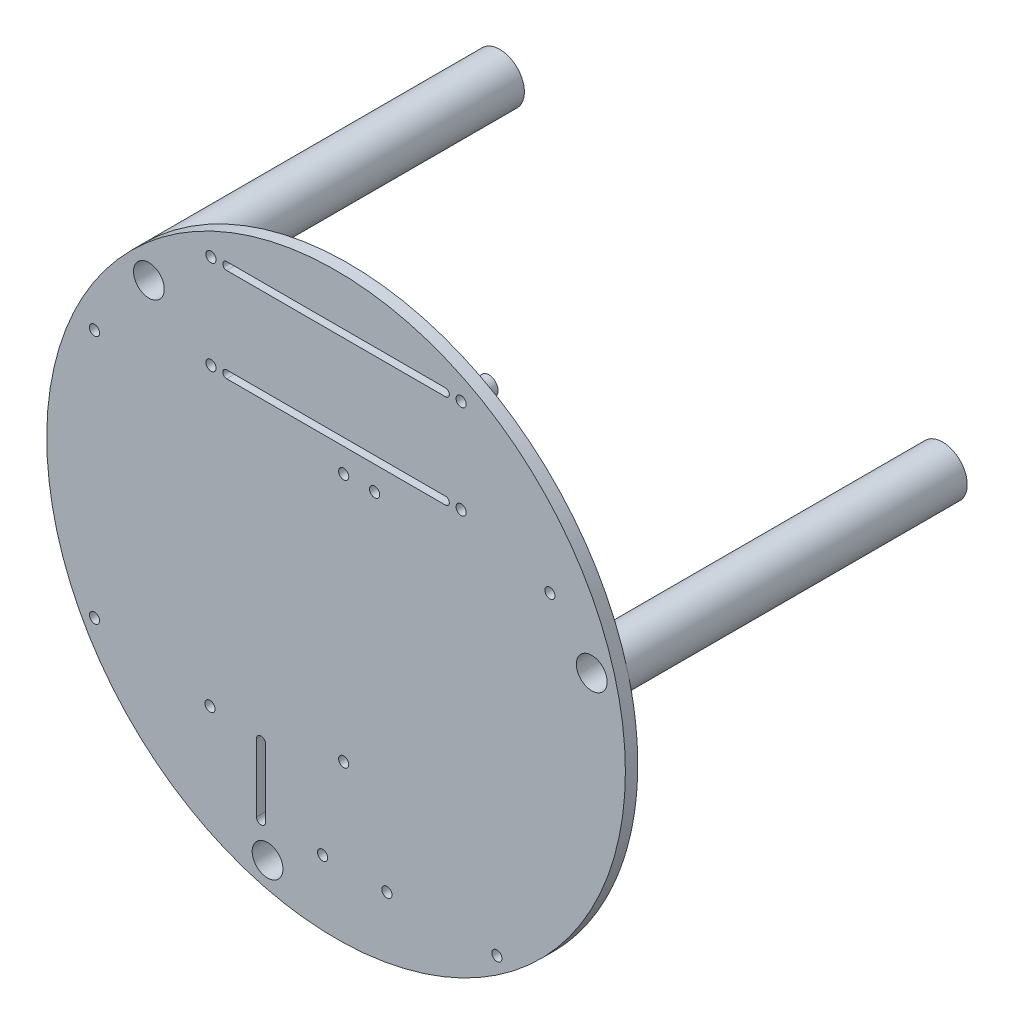
from build123d import *

# Parameters (mm, degrees)
SKETCH1_R                    = 47
BOSS_EXTRUDE1_DEPTH          = 2
SKETCH3_R                    = 2.5
CUT_EXTRUDE1_DEPTH           = 67.498120274
BOSS_EXTRUDE2_START          = 55
SKETCH5_R                    = 4
SKETCH5_R_2                  = 2.5
BOSS_EXTRUDE2_DEPTH          = 55
SKETCH2_R                    = 0.825
CUT_EXTRUDE_NANO_RECTO_DEPTH = 88.561407024
SKETCH6_R                    = 1.5
SKETCH6_R_2                  = 0.825
BOSS_EXTRUDE3_DEPTH          = 2.5
SKETCH4_R                    = 0.825
CUT_EXTRUDE_VERSO_DEPTH      = 87.272823067


with BuildPart() as part:
    # Sketch1 → Boss-Extrude1 (new body)
    with BuildSketch(Plane.XY):
        Circle(SKETCH1_R)
    extrude(amount=BOSS_EXTRUDE1_DEPTH)

    # Sketch3 → Cut-Extrude1 (cut, through all)
    with BuildSketch(Plane(origin=(0, 0, 0), x_dir=(-1, 0, 0), z_dir=(0, 0, -1))):
        with Locations((30.405591591, 30.405591591)):
            Circle(SKETCH3_R)
        with Locations((11.129218939, -41.53481053)):
            Circle(SKETCH3_R)
        with Locations((-41.53481053, 11.129218939)):
            Circle(SKETCH3_R)
    extrude(amount=-CUT_EXTRUDE1_DEPTH, mode=Mode.SUBTRACT)

    # Sketch5 → Boss-Extrude2 (add)
    # profile 1 of 3: a face of its own
    with BuildSketch(Plane(origin=(0, 0, 0), x_dir=(-1, 0, 0), z_dir=(0, 0, -1)).offset(BOSS_EXTRUDE2_START)):
        with Locations(Location((30.405591591, 30.405591591, 0), (0, 0, 44.999576406))):
            Circle(SKETCH5_R)
        with Locations((30.405591591, 30.405591591)):
            Circle(SKETCH5_R_2, mode=Mode.SUBTRACT)
    # profile 2 of 3: a face of its own
    with BuildSketch(Plane(origin=(0, 0, 0), x_dir=(-1, 0, 0), z_dir=(0, 0, -1)).offset(BOSS_EXTRUDE2_START)):
        with Locations(Location((11.129218939, -41.53481053, 0), (0, 0, 284.999570993))):
            Circle(SKETCH5_R)
        with Locations((11.129218939, -41.53481053)):
            Circle(SKETCH5_R_2, mode=Mode.SUBTRACT)
    # profile 3 of 3: a face of its own
    with BuildSketch(Plane(origin=(0, 0, 0), x_dir=(-1, 0, 0), z_dir=(0, 0, -1)).offset(BOSS_EXTRUDE2_START)):
        with Locations(Location((-41.53481053, 11.129218939, 0), (0, 0, 164.999581917))):
            Circle(SKETCH5_R)
        with Locations((-41.53481053, 11.129218939)):
            Circle(SKETCH5_R_2, mode=Mode.SUBTRACT)
    extrude(amount=-BOSS_EXTRUDE2_DEPTH)

    # Sketch2 → Cut-Extrude-Nano+Recto (cut, through all)
    with BuildSketch(Plane.XY.offset(2)):
        with Locations((20.32, 38.74)):
            Circle(SKETCH2_R)
        with Locations((20.32, 23.5)):
            Circle(SKETCH2_R)
        with Locations((-20.32, 23.5)):
            Circle(SKETCH2_R)
        with Locations((-20.32, 38.74)):
            Circle(SKETCH2_R)
        with Locations((34.74, 18.98)):
            Circle(SKETCH2_R)
        with Locations((6.26, 18.98)):
            Circle(SKETCH2_R)
        with Locations((-39.24, 18.98)):
            Circle(SKETCH2_R)
        with Locations((1.24, 18.98)):
            Circle(SKETCH2_R)
        with Locations((1.24, -21.5)):
            Circle(SKETCH2_R)
        with Locations((-39.24, -21.5)):
            Circle(SKETCH2_R)
        with BuildLine():
            Line((17.78, 22.875), (-17.78, 22.875))
            ThreePointArc((-17.78, 22.875), (-18.405, 23.5), (-17.78, 24.125))
            Line((-17.78, 24.125), (17.78, 24.125))
            ThreePointArc((17.78, 24.125), (18.405, 23.5), (17.78, 22.875))
        make_face()
        with BuildLine():
            Line((17.78, 39.365), (-17.78, 39.365))
            ThreePointArc((-17.78, 39.365), (-18.405, 38.74), (-17.78, 38.115))
            Line((-17.78, 38.115), (17.78, 38.115))
            ThreePointArc((17.78, 38.115), (18.405, 38.74), (17.78, 39.365))
        make_face()
    extrude(amount=-CUT_EXTRUDE_NANO_RECTO_DEPTH, mode=Mode.SUBTRACT)

    # Sketch6 → Boss-Extrude3 (add)
    # profile 1 of 10: a face of its own
    with BuildSketch(Plane(origin=(0, 0, 0), x_dir=(-1, 0, 0), z_dir=(0, 0, -1))):
        with Locations(Location((-34.74, 18.98, 0), (0, 0, 180))):
            Circle(SKETCH6_R)
        with Locations(Location((-34.74, 18.98, 0), (0, 0, 180))):
            Circle(SKETCH6_R_2, mode=Mode.SUBTRACT)
    # profile 2 of 10: a face of its own
    with BuildSketch(Plane(origin=(0, 0, 0), x_dir=(-1, 0, 0), z_dir=(0, 0, -1))):
        with Locations(Location((-20.32, 23.5, 0), (0, 0, 180))):
            Circle(SKETCH6_R)
        with Locations(Location((-20.32, 23.5, 0), (0, 0, 180))):
            Circle(SKETCH6_R_2, mode=Mode.SUBTRACT)
    # profile 3 of 10: a face of its own
    with BuildSketch(Plane(origin=(0, 0, 0), x_dir=(-1, 0, 0), z_dir=(0, 0, -1))):
        with Locations(Location((-20.32, 38.74, 0), (0, 0, 180))):
            Circle(SKETCH6_R)
        with Locations(Location((-20.32, 38.74, 0), (0, 0, 180))):
            Circle(SKETCH6_R_2, mode=Mode.SUBTRACT)
    # profile 4 of 10: a face of its own
    with BuildSketch(Plane(origin=(0, 0, 0), x_dir=(-1, 0, 0), z_dir=(0, 0, -1))):
        with Locations(Location((20.32, 23.5, 0), (0, 0, 180))):
            Circle(SKETCH6_R)
        with Locations(Location((20.32, 23.5, 0), (0, 0, 180))):
            Circle(SKETCH6_R_2, mode=Mode.SUBTRACT)
    # profile 5 of 10: a face of its own
    with BuildSketch(Plane(origin=(0, 0, 0), x_dir=(-1, 0, 0), z_dir=(0, 0, -1))):
        with Locations(Location((20.32, 38.74, 0), (0, 0, 180))):
            Circle(SKETCH6_R)
        with Locations(Location((20.32, 38.74, 0), (0, 0, 180))):
            Circle(SKETCH6_R_2, mode=Mode.SUBTRACT)
    # profile 6 of 10: a face of its own
    with BuildSketch(Plane(origin=(0, 0, 0), x_dir=(-1, 0, 0), z_dir=(0, 0, -1))):
        with Locations(Location((-6.26, 18.98, 0), (0, 0, 180))):
            Circle(SKETCH6_R)
        with Locations(Location((-6.26, 18.98, 0), (0, 0, 180))):
            Circle(SKETCH6_R_2, mode=Mode.SUBTRACT)
    # profile 7 of 10: a face of its own
    with BuildSketch(Plane(origin=(0, 0, 0), x_dir=(-1, 0, 0), z_dir=(0, 0, -1))):
        with Locations(Location((-1.24, 18.98, 0), (0, 0, 180))):
            Circle(SKETCH6_R)
        with Locations(Location((-1.24, 18.98, 0), (0, 0, 180))):
            Circle(SKETCH6_R_2, mode=Mode.SUBTRACT)
    # profile 8 of 10: a face of its own
    with BuildSketch(Plane(origin=(0, 0, 0), x_dir=(-1, 0, 0), z_dir=(0, 0, -1))):
        with Locations(Location((39.24, 18.98, 0), (0, 0, 180))):
            Circle(SKETCH6_R)
        with Locations(Location((39.24, 18.98, 0), (0, 0, 180))):
            Circle(SKETCH6_R_2, mode=Mode.SUBTRACT)
    # profile 9 of 10: a face of its own
    with BuildSketch(Plane(origin=(0, 0, 0), x_dir=(-1, 0, 0), z_dir=(0, 0, -1))):
        with Locations(Location((39.24, -21.5, 0), (0, 0, 180))):
            Circle(SKETCH6_R)
        with Locations(Location((39.24, -21.5, 0), (0, 0, 180))):
            Circle(SKETCH6_R_2, mode=Mode.SUBTRACT)
    # profile 10 of 10: a face of its own
    with BuildSketch(Plane(origin=(0, 0, 0), x_dir=(-1, 0, 0), z_dir=(0, 0, -1))):
        with Locations(Location((-1.24, -21.5, 0), (0, 0, 180))):
            Circle(SKETCH6_R)
        with Locations(Location((-1.24, -21.5, 0), (0, 0, 180))):
            Circle(SKETCH6_R_2, mode=Mode.SUBTRACT)
    extrude(amount=BOSS_EXTRUDE3_DEPTH)

    # Sketch4 → Cut-Extrude-Verso (cut, through all)
    with BuildSketch(Plane(origin=(0, 0, 0), x_dir=(-1, 0, 0), z_dir=(0, 0, -1))):
        with Locations((-8.26, -36.34)):
            Circle(SKETCH4_R)
        with Locations((2.18, -36.34)):
            Circle(SKETCH4_R)
        with Locations(Location((-26.13, -36.34, 0), (0, 0, 180))):
            Circle(SKETCH4_R)
        with Locations((20.48, -24.54)):
            Circle(SKETCH4_R)
        with BuildLine():
            Line((11.43, -36.34), (11.43, -25.34))
            ThreePointArc((11.43, -25.34), (12.18, -24.59), (12.93, -25.34))
            Line((12.93, -25.34), (12.93, -36.34))
            ThreePointArc((12.93, -36.34), (12.18, -37.09), (11.43, -36.34))
        make_face()
    extrude(amount=-CUT_EXTRUDE_VERSO_DEPTH, mode=Mode.SUBTRACT)


solid = part.part
